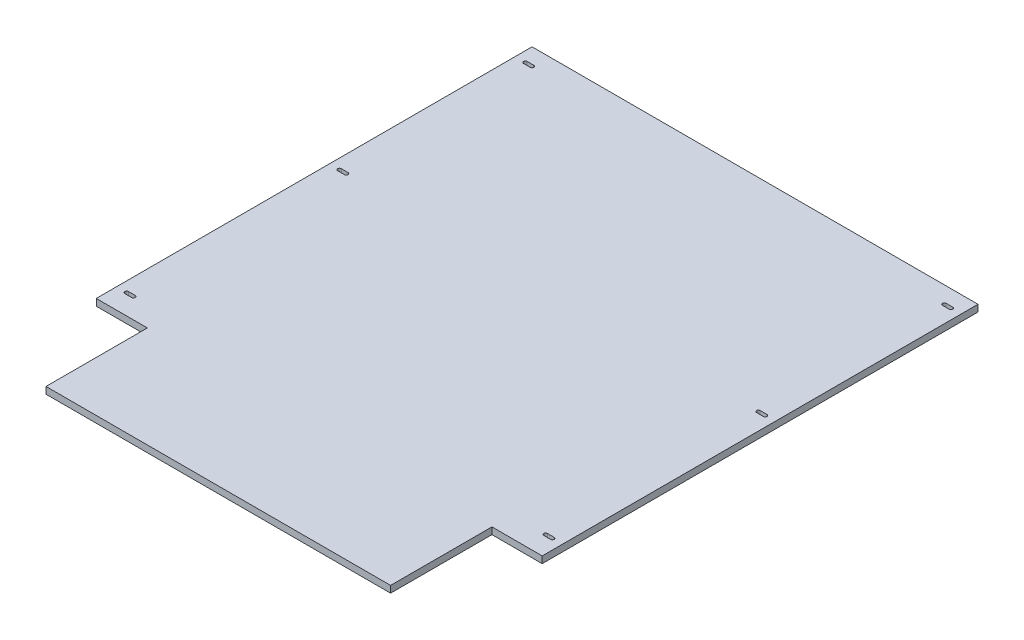
from build123d import *

# Parameters (mm, degrees)
BOSS_EXTRUDE1_DEPTH = 12.7


with BuildPart() as part:
    # Sketch1 → Boss-Extrude1 (new body)
    with BuildSketch(Plane(origin=(0, 0, 0), x_dir=(1, 0, 0), z_dir=(0, 1, 0))):
        Polygon((0, 0), (96.04375, 0), (96.04375, -190.5), (743.74375, -190.5), (743.74375, 0), (838.2, 0), (838.2, 819.15), (0, 819.15), align=None)
        with BuildLine():
            Line((19.05, 41.4782), (31.75, 41.4782))
            ThreePointArc((31.75, 41.4782), (35.1282, 38.1), (31.75, 34.7218))
            Line((31.75, 34.7218), (19.05, 34.7218))
            ThreePointArc((19.05, 34.7218), (15.6718, 38.1), (19.05, 41.4782))
        make_face(mode=Mode.SUBTRACT)
        with BuildLine():
            Line((19.05, 441.5282), (31.75, 441.5282))
            ThreePointArc((31.75, 441.5282), (35.1282, 438.15), (31.75, 434.7718))
            Line((31.75, 434.7718), (19.05, 434.7718))
            ThreePointArc((19.05, 434.7718), (15.6718, 438.15), (19.05, 441.5282))
        make_face(mode=Mode.SUBTRACT)
        with BuildLine():
            Line((31.75, 784.0218), (19.05, 784.0218))
            ThreePointArc((19.05, 784.0218), (15.6718, 787.4), (19.05, 790.7782))
            Line((19.05, 790.7782), (31.75, 790.7782))
            ThreePointArc((31.75, 790.7782), (35.1282, 787.4), (31.75, 784.0218))
        make_face(mode=Mode.SUBTRACT)
        with BuildLine():
            Line((806.45, 784.0218), (819.15, 784.0218))
            ThreePointArc((819.15, 784.0218), (822.5282, 787.4), (819.15, 790.7782))
            Line((819.15, 790.7782), (806.45, 790.7782))
            ThreePointArc((806.45, 790.7782), (803.0718, 787.4), (806.45, 784.0218))
        make_face(mode=Mode.SUBTRACT)
        with BuildLine():
            Line((819.15, 441.5282), (806.45, 441.5282))
            ThreePointArc((806.45, 441.5282), (803.0718, 438.15), (806.45, 434.7718))
            Line((806.45, 434.7718), (819.15, 434.7718))
            ThreePointArc((819.15, 434.7718), (822.5282, 438.15), (819.15, 441.5282))
        make_face(mode=Mode.SUBTRACT)
        with BuildLine():
            Line((819.15, 41.4782), (806.45, 41.4782))
            ThreePointArc((806.45, 41.4782), (803.0718, 38.1), (806.45, 34.7218))
            Line((806.45, 34.7218), (819.15, 34.7218))
            ThreePointArc((819.15, 34.7218), (822.5282, 38.1), (819.15, 41.4782))
        make_face(mode=Mode.SUBTRACT)
    extrude(amount=BOSS_EXTRUDE1_DEPTH)


solid = part.part
